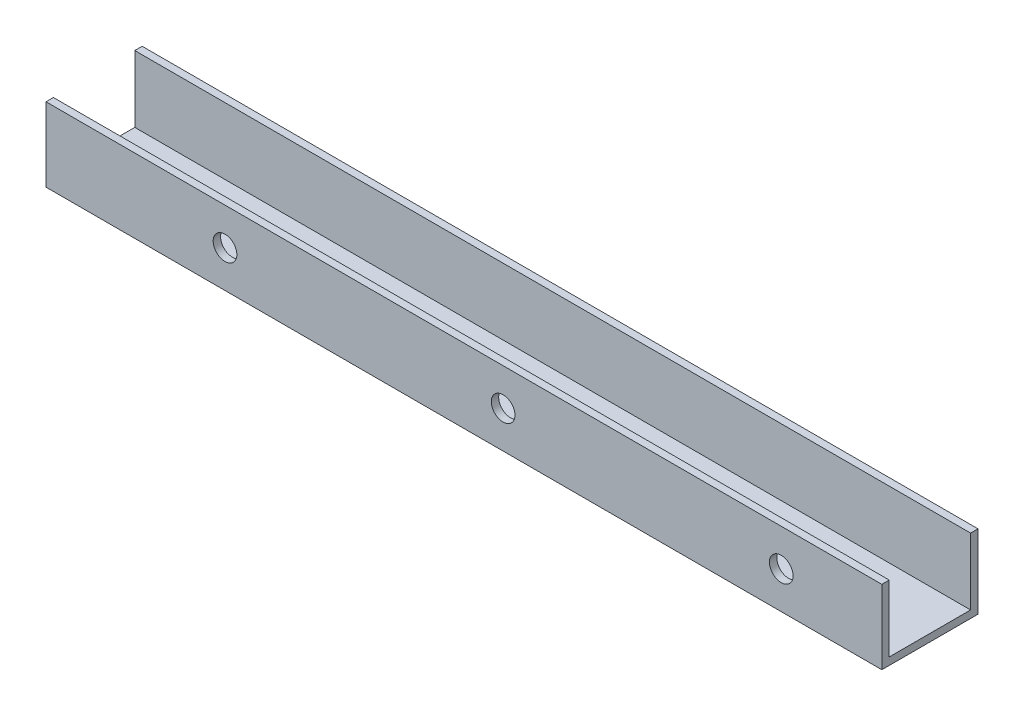
from build123d import *

# Parameters (mm, degrees)
ESQUISSE1_W             = 113
ESQUISSE1_H             = 13
ESQUISSE1_R             = 1.6
BOSS_EXTRU_1_DEPTH      = 1
ESQUISSE2_W             = 113
ESQUISSE2_H             = 1
BOSS_EXTRU_2_DEPTH      = 9
ENL_V_MAT_EXTRU_1_REACH = 116.184
ESQUISSE3_R             = 1.6


with BuildPart() as part:
    # Esquisse1 → Boss.-Extru.1 (new body)
    with BuildSketch(Plane(origin=(0, 0, 0), x_dir=(1, 0, 0), z_dir=(0, 1, 0))):
        with Locations((56.5, 6.5)):
            Rectangle(ESQUISSE1_W, ESQUISSE1_H)
        with Locations(Location((79, 6.5, 0), (0, 0, 270))):
            Circle(ESQUISSE1_R, mode=Mode.SUBTRACT)
        with Locations(Location((29.5, 6.5, 0), (0, 0, 270))):
            Circle(ESQUISSE1_R, mode=Mode.SUBTRACT)
    extrude(amount=BOSS_EXTRU_1_DEPTH)

    # Esquisse2 → Boss.-Extru.2 (add)
    with BuildSketch(Plane(origin=(0, 1, 0), x_dir=(1, 0, 0), z_dir=(0, 1, 0))):
        with Locations((56.5, 12.5)):
            Rectangle(ESQUISSE2_W, ESQUISSE2_H)
        with Locations((56.5, 0.5)):
            Rectangle(ESQUISSE2_W, ESQUISSE2_H)
    extrude(amount=BOSS_EXTRU_2_DEPTH)

    # Esquisse3 → Enlèv. mat.-Extru.1 (cut, up to next)
    with BuildSketch(Plane.XY, mode=Mode.PRIVATE) as enl_v_mat_extru_1_sk1:
        with Locations((99.4, 5)):
            Circle(ESQUISSE3_R)
    enl_v_mat_extru_1_tool1 = extrude(enl_v_mat_extru_1_sk1.sketch, amount=-ENL_V_MAT_EXTRU_1_REACH, mode=Mode.PRIVATE) & part.part
    # Esquisse3 → Enlèv. mat.-Extru.1 (cut, up to next)
    with BuildSketch(Plane.XY, mode=Mode.PRIVATE) as enl_v_mat_extru_1_sk2:
        with Locations((61.8, 5)):
            Circle(ESQUISSE3_R)
    enl_v_mat_extru_1_tool2 = extrude(enl_v_mat_extru_1_sk2.sketch, amount=-ENL_V_MAT_EXTRU_1_REACH, mode=Mode.PRIVATE) & part.part
    # Esquisse3 → Enlèv. mat.-Extru.1 (cut, up to next)
    with BuildSketch(Plane.XY, mode=Mode.PRIVATE) as enl_v_mat_extru_1_sk3:
        with Locations((24.2, 5)):
            Circle(ESQUISSE3_R)
    enl_v_mat_extru_1_tool3 = extrude(enl_v_mat_extru_1_sk3.sketch, amount=-ENL_V_MAT_EXTRU_1_REACH, mode=Mode.PRIVATE) & part.part
    add(enl_v_mat_extru_1_tool1.solids().sort_by_distance((99.4, 5, 0))[0], mode=Mode.SUBTRACT)
    add(enl_v_mat_extru_1_tool2.solids().sort_by_distance((61.8, 5, 0))[0], mode=Mode.SUBTRACT)
    add(enl_v_mat_extru_1_tool3.solids().sort_by_distance((24.2, 5, 0))[0], mode=Mode.SUBTRACT)


solid = part.part
